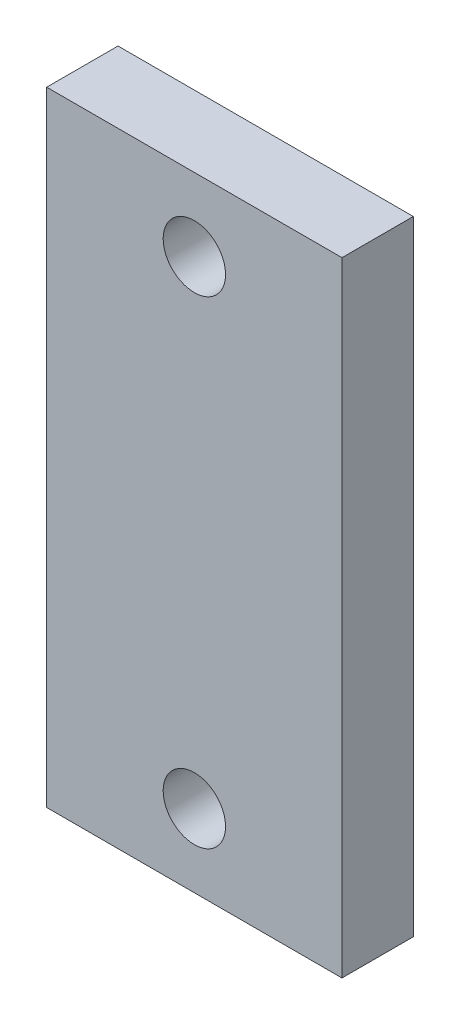
from build123d import *

# Parameters (mm, degrees)
CROQUIS1_W              = 14.2
CROQUIS1_H              = 30
CROQUIS1_R              = 1.5
SALIENTE_EXTRUIR1_DEPTH = 3.43


with BuildPart() as part:
    # Croquis1 → Saliente-Extruir1 (new body)
    with BuildSketch(Plane.XY):
        with Locations((96.832371, -125.148646)):
            Rectangle(CROQUIS1_W, CROQUIS1_H)
        with Locations(Location((96.833621, -136.643646, 0), (0, 0, 180))):
            Circle(CROQUIS1_R, mode=Mode.SUBTRACT)
        with Locations(Location((96.833621, -113.653646, 0), (0, 0, 180))):
            Circle(CROQUIS1_R, mode=Mode.SUBTRACT)
    extrude(amount=SALIENTE_EXTRUIR1_DEPTH)


solid = part.part
